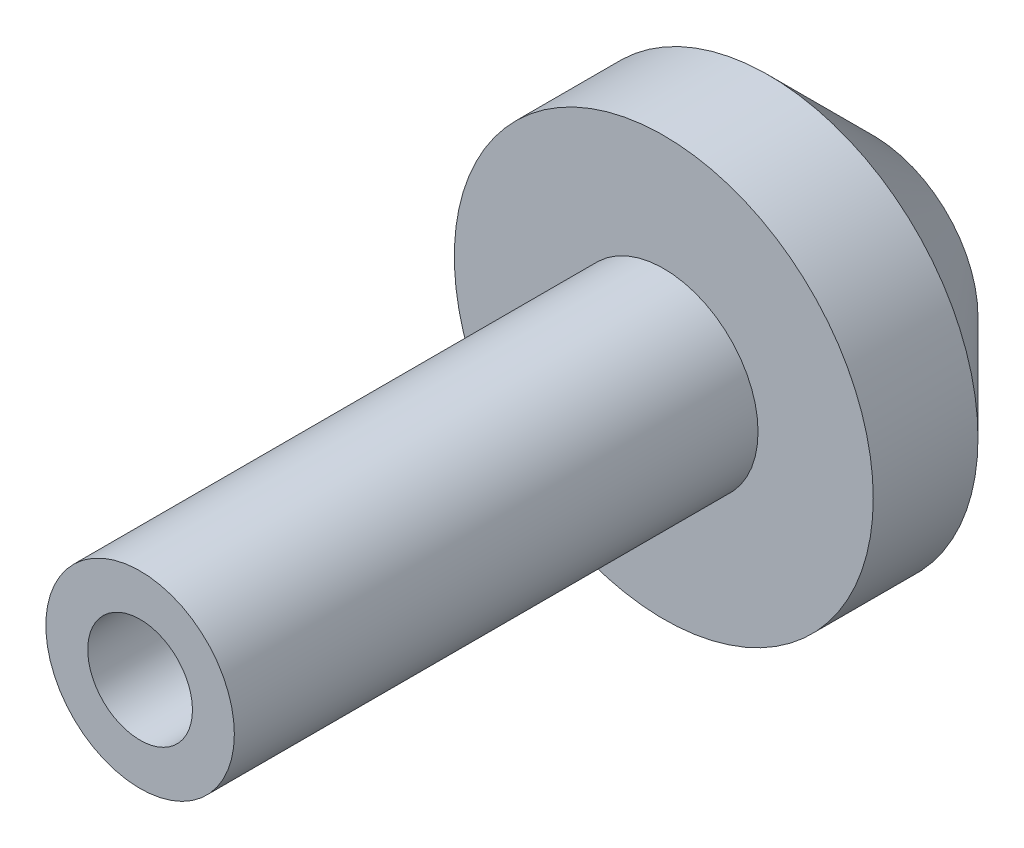
from build123d import *

# Parameters (mm, degrees)
SKETCH1_R           = 5
BOSS_EXTRUDE1_DEPTH = 5
SKETCH2_R           = 2.25
BOSS_EXTRUDE2_DEPTH = 12.5
SKETCH3_R           = 1.25
CUT_EXTRUDE1_DEPTH  = 10
CHAMFER1_SIZE       = 2.5


with BuildPart() as part:
    # Sketch1 → Boss-Extrude1 (new body)
    with BuildSketch(Plane.XY):
        Circle(SKETCH1_R)
    extrude(amount=BOSS_EXTRUDE1_DEPTH)

    # Sketch2 → Boss-Extrude2 (add)
    with BuildSketch(Plane.XY.offset(5)):
        Circle(SKETCH2_R)
    extrude(amount=BOSS_EXTRUDE2_DEPTH)

    # Sketch3 → Cut-Extrude1 (cut)
    with BuildSketch(Plane.XY.offset(17.5)):
        Circle(SKETCH3_R)
    extrude(amount=-CUT_EXTRUDE1_DEPTH, mode=Mode.SUBTRACT)

    # Chamfer1
    chamfer1_edges = [part.edges().sort_by_distance(p)[0] for p in [
        (-5, 0, 0),
    ]]
    chamfer(chamfer1_edges, length=CHAMFER1_SIZE)


solid = part.part
